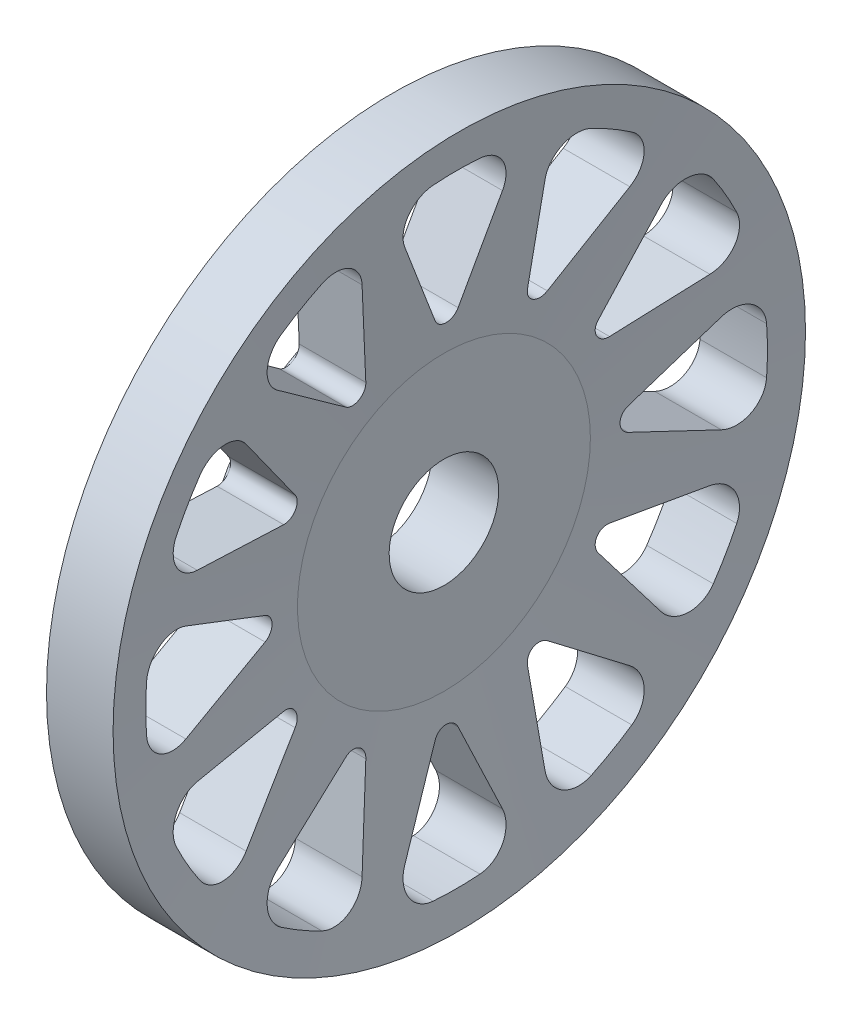
from build123d import *

# Parameters (mm, degrees)
CUT_EXTRUDE1_DEPTH      = 24.768008436
CUT_EXTRUDE1_DEPTH_BACK = 24.768008436
CUT_EXTRUDE2_DEPTH      = 24.685397107
CUT_EXTRUDE2_DEPTH_BACK = 24.685397107
SKETCH14_R              = 8.297671794
BOSS_EXTRUDE1_DEPTH     = 1.27
CUT_EXTRUDE11_START     = 1.27
SKETCH15_R              = 8.297671794
CUT_EXTRUDE11_DEPTH     = 1.27
SKETCH17_R              = 7.565667329
SKETCH17_R_2            = 2.6125
BOSS_EXTRUDE2_DEPTH     = 3.175


with BuildPart() as part:
    # Sketch2 → Revolve1 (revolve)
    with BuildSketch(Plane(origin=(0, 0, 0), x_dir=(1, 0, 0), z_dir=(0, 1, 0))):
        Polygon((0, 0), (1.27, 16.51), (4.445, 16.51), (3.175, 0), align=None)
    revolve(axis=Axis((3.175, 0, 0), (-1, 0, 0)))

    # Sketch3 → Cut-Extrude1 (cut, two sides: drawn at the far end of the back side and taken through both)
    with BuildSketch(Plane(origin=(0, 0, 0), x_dir=(0, 0, -1), z_dir=(1, 0, 0)).offset(-CUT_EXTRUDE1_DEPTH_BACK)):
        Polygon((-3.4925, 6.049187445), (-6.985, 0), (-3.4925, -6.049187445), (3.4925, -6.049187445), (6.985, 0), (3.4925, 6.049187445), align=None)
    extrude(amount=CUT_EXTRUDE1_DEPTH + CUT_EXTRUDE1_DEPTH_BACK, mode=Mode.SUBTRACT)

    # Sketch4 → Cut-Extrude2 (cut, two sides: drawn at the far end of the back side and taken through both)
    with BuildSketch(Plane(origin=(4.445, 0, 0), x_dir=(0, 0, -1), z_dir=(1, 0, 0)).offset(-CUT_EXTRUDE2_DEPTH_BACK)):
        with BuildLine():
            Line((-2.331781543, 12.767127605), (-0.547536169, 8.656887648))
            ThreePointArc((-0.547536169, 8.656887648), (0, 8.297671794), (0.547536169, 8.656887648))
            Line((0.547536169, 8.656887648), (2.331781543, 12.767127605))
            ThreePointArc((2.331781543, 12.767127605), (2.243533249, 14.088232626), (1.115854015, 14.782095569))
            ThreePointArc((1.115854015, 14.782095569), (0, 14.824151901), (-1.115854015, 14.782095569))
            ThreePointArc((-1.115854015, 14.782095569), (-2.243533249, 14.088232626), (-2.331781543, 12.767127605))
        make_face()
        with BuildLine():
            Line((4.36418175, 12.22254761), (3.854263592, 7.770852705))
            ThreePointArc((3.854263592, 7.770852705), (4.148835897, 7.185994566), (4.802624056, 7.223316536))
            Line((4.802624056, 7.223316536), (8.402945854, 9.890766068))
            ThreePointArc((8.402945854, 9.890766068), (8.987073101, 11.079000724), (8.357405708, 12.243743276))
            ThreePointArc((8.357405708, 12.243743276), (7.412075951, 12.838092136), (6.424689861, 13.359597291))
            ThreePointArc((6.424689861, 13.359597291), (5.101159525, 13.322533973), (4.36418175, 12.22254761))
        make_face()
        with BuildLine():
            Line((9.890766068, 8.402945854), (7.223316536, 4.802624056))
            ThreePointArc((7.223316536, 4.802624056), (7.185994566, 4.148835897), (7.770852705, 3.854263592))
            Line((7.770852705, 3.854263592), (12.22254761, 4.36418175))
            ThreePointArc((12.22254761, 4.36418175), (13.322533973, 5.101159525), (13.359597291, 6.424689861))
            ThreePointArc((13.359597291, 6.424689861), (12.838092136, 7.412075951), (12.243743276, 8.357405708))
            ThreePointArc((12.243743276, 8.357405708), (11.079000724, 8.987073101), (9.890766068, 8.402945854))
        make_face()
        with BuildLine():
            Line((12.767127605, 2.331781543), (8.656887648, 0.547536169))
            ThreePointArc((8.656887648, 0.547536169), (8.297671794, 0), (8.656887648, -0.547536169))
            Line((8.656887648, -0.547536169), (12.767127605, -2.331781543))
            ThreePointArc((12.767127605, -2.331781543), (14.088232626, -2.243533249), (14.782095569, -1.115854015))
            ThreePointArc((14.782095569, -1.115854015), (14.824151901, 0), (14.782095569, 1.115854015))
            ThreePointArc((14.782095569, 1.115854015), (14.088232626, 2.243533249), (12.767127605, 2.331781543))
        make_face()
        with BuildLine():
            Line((12.22254761, -4.36418175), (7.770852705, -3.854263592))
            ThreePointArc((7.770852705, -3.854263592), (7.185994566, -4.148835897), (7.223316536, -4.802624056))
            Line((7.223316536, -4.802624056), (9.890766068, -8.402945854))
            ThreePointArc((9.890766068, -8.402945854), (11.079000724, -8.987073101), (12.243743276, -8.357405708))
            ThreePointArc((12.243743276, -8.357405708), (12.838092136, -7.412075951), (13.359597291, -6.424689861))
            ThreePointArc((13.359597291, -6.424689861), (13.322533973, -5.101159525), (12.22254761, -4.36418175))
        make_face()
        with BuildLine():
            Line((8.402945854, -9.890766068), (4.802624056, -7.223316536))
            ThreePointArc((4.802624056, -7.223316536), (4.148835897, -7.185994566), (3.854263592, -7.770852705))
            Line((3.854263592, -7.770852705), (4.36418175, -12.22254761))
            ThreePointArc((4.36418175, -12.22254761), (5.101159525, -13.322533973), (6.424689861, -13.359597291))
            ThreePointArc((6.424689861, -13.359597291), (7.412075951, -12.838092136), (8.357405708, -12.243743276))
            ThreePointArc((8.357405708, -12.243743276), (8.987073101, -11.079000724), (8.402945854, -9.890766068))
        make_face()
        with BuildLine():
            Line((2.331781543, -12.767127605), (0.547536169, -8.656887648))
            ThreePointArc((0.547536169, -8.656887648), (0, -8.297671794), (-0.547536169, -8.656887648))
            Line((-0.547536169, -8.656887648), (-2.331781543, -12.767127605))
            ThreePointArc((-2.331781543, -12.767127605), (-2.243533249, -14.088232626), (-1.115854015, -14.782095569))
            ThreePointArc((-1.115854015, -14.782095569), (0, -14.824151901), (1.115854015, -14.782095569))
            ThreePointArc((1.115854015, -14.782095569), (2.243533249, -14.088232626), (2.331781543, -12.767127605))
        make_face()
        with BuildLine():
            Line((-4.36418175, -12.22254761), (-3.854263592, -7.770852705))
            ThreePointArc((-3.854263592, -7.770852705), (-4.148835897, -7.185994566), (-4.802624056, -7.223316536))
            Line((-4.802624056, -7.223316536), (-8.402945854, -9.890766068))
            ThreePointArc((-8.402945854, -9.890766068), (-8.987073101, -11.079000724), (-8.357405708, -12.243743276))
            ThreePointArc((-8.357405708, -12.243743276), (-7.412075951, -12.838092136), (-6.424689861, -13.359597291))
            ThreePointArc((-6.424689861, -13.359597291), (-5.101159525, -13.322533973), (-4.36418175, -12.22254761))
        make_face()
        with BuildLine():
            Line((-9.890766068, -8.402945854), (-7.223316536, -4.802624056))
            ThreePointArc((-7.223316536, -4.802624056), (-7.185994566, -4.148835897), (-7.770852705, -3.854263592))
            Line((-7.770852705, -3.854263592), (-12.22254761, -4.36418175))
            ThreePointArc((-12.22254761, -4.36418175), (-13.322533973, -5.101159525), (-13.359597291, -6.424689861))
            ThreePointArc((-13.359597291, -6.424689861), (-12.838092136, -7.412075951), (-12.243743276, -8.357405708))
            ThreePointArc((-12.243743276, -8.357405708), (-11.079000724, -8.987073101), (-9.890766068, -8.402945854))
        make_face()
        with BuildLine():
            Line((-12.767127605, -2.331781543), (-8.656887648, -0.547536169))
            ThreePointArc((-8.656887648, -0.547536169), (-8.297671794, 0), (-8.656887648, 0.547536169))
            Line((-8.656887648, 0.547536169), (-12.767127605, 2.331781543))
            ThreePointArc((-12.767127605, 2.331781543), (-14.088232626, 2.243533249), (-14.782095569, 1.115854015))
            ThreePointArc((-14.782095569, 1.115854015), (-14.824151901, 0), (-14.782095569, -1.115854015))
            ThreePointArc((-14.782095569, -1.115854015), (-14.088232626, -2.243533249), (-12.767127605, -2.331781543))
        make_face()
        with BuildLine():
            Line((-12.22254761, 4.36418175), (-7.770852705, 3.854263592))
            ThreePointArc((-7.770852705, 3.854263592), (-7.185994566, 4.148835897), (-7.223316536, 4.802624056))
            Line((-7.223316536, 4.802624056), (-9.890766068, 8.402945854))
            ThreePointArc((-9.890766068, 8.402945854), (-11.079000724, 8.987073101), (-12.243743276, 8.357405708))
            ThreePointArc((-12.243743276, 8.357405708), (-12.838092136, 7.412075951), (-13.359597291, 6.424689861))
            ThreePointArc((-13.359597291, 6.424689861), (-13.322533973, 5.101159525), (-12.22254761, 4.36418175))
        make_face()
        with BuildLine():
            Line((-8.402945854, 9.890766068), (-4.802624056, 7.223316536))
            ThreePointArc((-4.802624056, 7.223316536), (-4.148835897, 7.185994566), (-3.854263592, 7.770852705))
            Line((-3.854263592, 7.770852705), (-4.36418175, 12.22254761))
            ThreePointArc((-4.36418175, 12.22254761), (-5.101159525, 13.322533973), (-6.424689861, 13.359597291))
            ThreePointArc((-6.424689861, 13.359597291), (-7.412075951, 12.838092136), (-8.357405708, 12.243743276))
            ThreePointArc((-8.357405708, 12.243743276), (-8.987073101, 11.079000724), (-8.402945854, 9.890766068))
        make_face()
    extrude(amount=CUT_EXTRUDE2_DEPTH + CUT_EXTRUDE2_DEPTH_BACK, mode=Mode.SUBTRACT)

    # Sketch14 → Boss-Extrude1 (add)
    with BuildSketch(Plane(origin=(0.537307692, 0, 0), x_dir=(0, 0, -1), z_dir=(1, 0, 0))):
        with Locations(Location((0, 0, 0), (0, 0, 90))):
            Circle(SKETCH14_R)
        Polygon((-3.4925, 6.049187445), (3.4925, 6.049187445), (6.985, 0), (3.4925, -6.049187445), (-3.4925, -6.049187445), (-6.985, 0), align=None, mode=Mode.SUBTRACT)
    extrude(amount=BOSS_EXTRUDE1_DEPTH)

    # Sketch15 → Cut-Extrude11 (cut)
    with BuildSketch(Plane.ZY.offset(-0.537307692).offset(CUT_EXTRUDE11_START)):
        with Locations(Location((0, 0, 0), (0, 0, 90))):
            Circle(SKETCH15_R)
    extrude(amount=-CUT_EXTRUDE11_DEPTH, mode=Mode.SUBTRACT)

    # Sketch17 → Boss-Extrude2 (add)
    with BuildSketch(Plane.ZY.offset(-0.537307692)):
        Circle(SKETCH17_R)
        with Locations(Location((0, 0, 0), (0, 0, 270))):
            Circle(SKETCH17_R_2, mode=Mode.SUBTRACT)
    extrude(amount=-BOSS_EXTRUDE2_DEPTH)


solid = part.part
